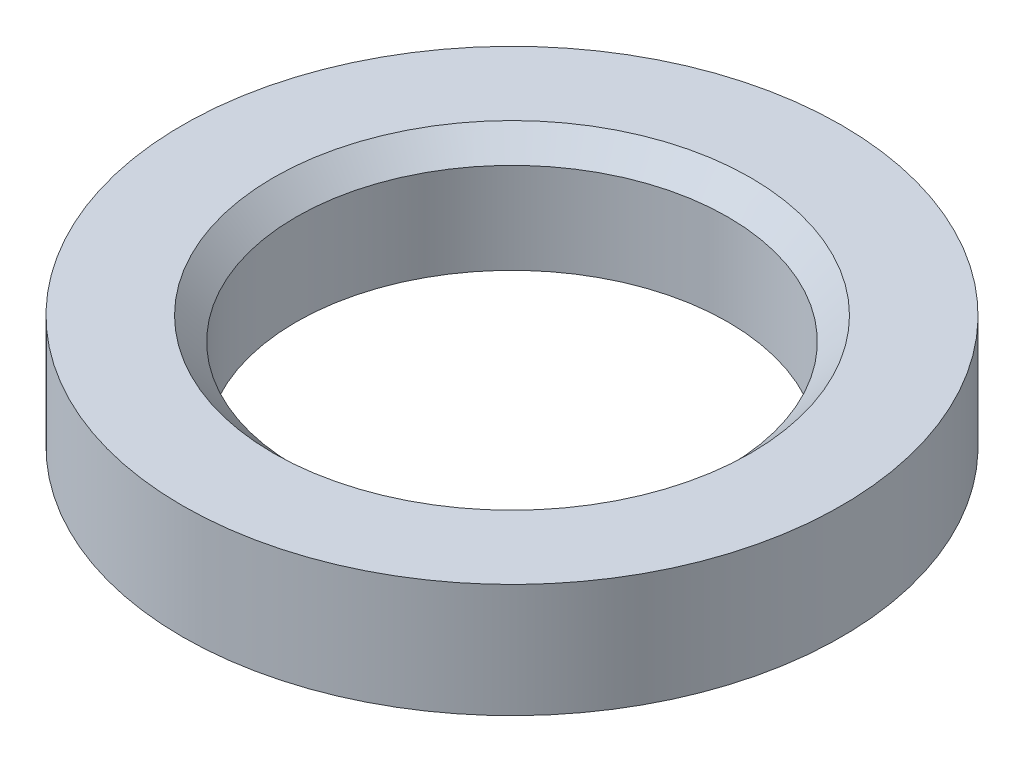
from build123d import *


with BuildPart() as part:
    # Sketch1 → Revolve1 (revolve)
    with BuildSketch(Plane.XY, mode=Mode.PRIVATE) as revolve1_sk:
        Polygon((9.5, 0), (14.5, 0), (14.5, 5), (10.5, 5), (9.5, 4), align=None)
    revolve(revolve1_sk.sketch.rotate(Axis((0, 0, 0), (0, 1, 0)), 90), axis=Axis((0, 0, 0), (0, 1, 0)))


solid = part.part
